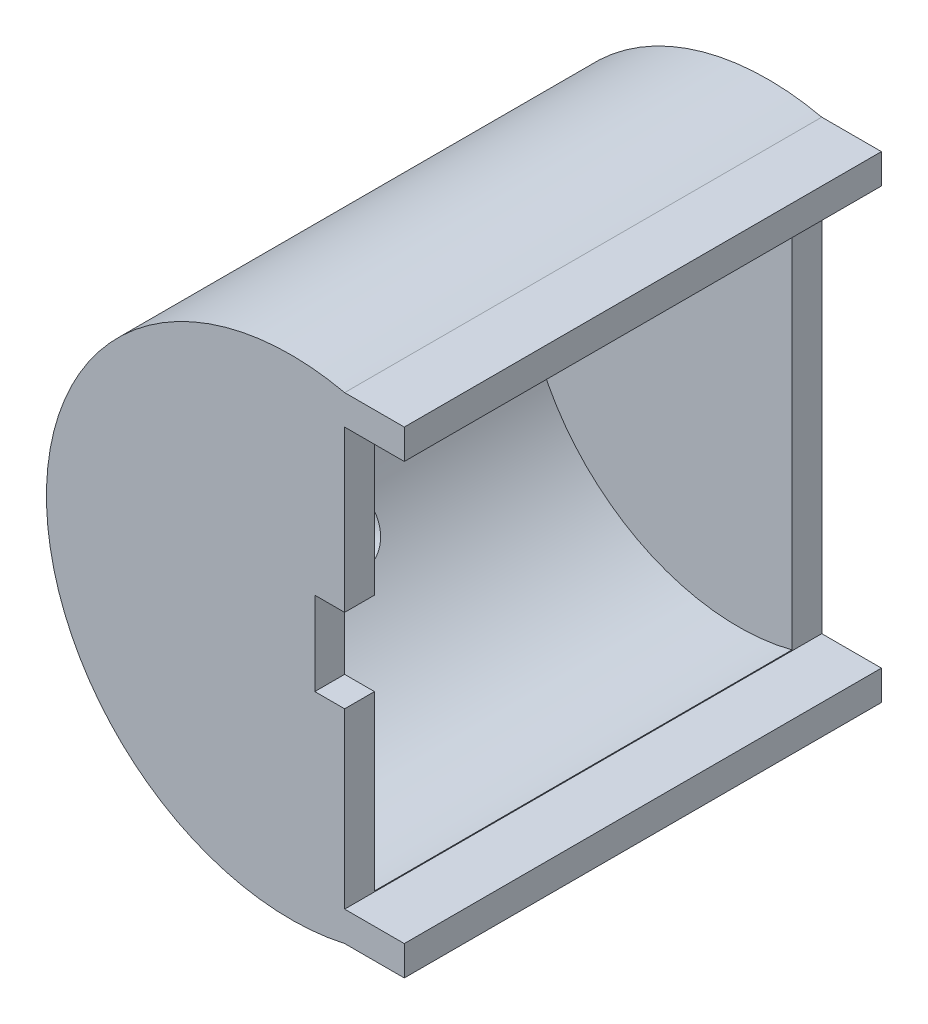
from build123d import *

# Parameters (mm, degrees)
BOSS_EXTRUDE1_DEPTH                      = 101.6
SHELL1_T                                 = -6.35
SKETCH3_W                                = 6.35
SKETCH3_H                                = 17.78
CUT_EXTRUDE1_DEPTH                       = 6.35
SKETCH4_W                                = 12.7
SKETCH4_H                                = 6.35
BOSS_EXTRUDE2_DEPTH                      = 101.6
SKETCH6_W                                = 12.7
SKETCH6_H                                = 6.35
BOSS_EXTRUDE3_DEPTH                      = 101.6
F_1_2_0_5_DIAMETER_HOLE1_D               = 12.7
F_1_2_0_5_DIAMETER_HOLE1_DEPTH           = 7.62
F_1_2_0_5_DIAMETER_HOLE1_TIP             = 3.815464931
F_1_2_0_5_DIAMETER_HOLE1_ON_FACE_2_D     = 12.7
F_1_2_0_5_DIAMETER_HOLE1_ON_FACE_2_DEPTH = 7.62
F_1_2_0_5_DIAMETER_HOLE1_ON_FACE_2_TIP   = 3.815464931
F_1_2_0_5_DIAMETER_HOLE1_ON_FACE_3_D     = 12.7
F_1_2_0_5_DIAMETER_HOLE1_ON_FACE_3_DEPTH = 7.62
F_1_2_0_5_DIAMETER_HOLE1_ON_FACE_3_TIP   = 3.815464931


with BuildPart() as part:
    # Sketch2 → Boss-Extrude1 (new body)
    with BuildSketch(Plane.XY):
        with BuildLine():
            Line((0, -50.8), (0, 0))
            Line((0, 0), (0, 50.8))
            ThreePointArc((0, 50.8), (-63.5, 0), (0, -50.8))
        make_face()
    extrude(amount=BOSS_EXTRUDE1_DEPTH)

    # Shell1
    shell1_openings = [part.faces().sort_by_distance(p)[0] for p in [
        (0, 0, 50.8),
    ]]
    offset(amount=SHELL1_T, openings=shell1_openings)

    # Sketch3 → Cut-Extrude1 (cut)
    with BuildSketch(Plane.XY.offset(101.6)):
        with Locations((-3.175, 1.38458233)):
            Rectangle(SKETCH3_W, SKETCH3_H)
    extrude(amount=-CUT_EXTRUDE1_DEPTH, mode=Mode.SUBTRACT)

    # Sketch4 → Boss-Extrude2 (add)
    with BuildSketch(Plane.XY.offset(101.6)):
        with Locations((6.35, 47.625)):
            Rectangle(SKETCH4_W, SKETCH4_H)
    extrude(amount=-BOSS_EXTRUDE2_DEPTH)

    # Sketch6 → Boss-Extrude3 (add)
    with BuildSketch(Plane.XY.offset(101.6)):
        with Locations((6.35, -47.625)):
            Rectangle(SKETCH6_W, SKETCH6_H)
    extrude(amount=-BOSS_EXTRUDE3_DEPTH)

    # 1/2 (0.5) Diameter Hole1
    with Locations(Plane(origin=(-63.499461497, -0.236811011, 51.161863275), x_dir=(0.004547935689, -0.999989658087, 0), z_dir=(-0.999989658087, -0.004547935689, 0))):
        with Locations((0, 0)):
            Hole(F_1_2_0_5_DIAMETER_HOLE1_D / 2, depth=F_1_2_0_5_DIAMETER_HOLE1_DEPTH)
            with Locations((0, 0, -(F_1_2_0_5_DIAMETER_HOLE1_DEPTH + F_1_2_0_5_DIAMETER_HOLE1_TIP / 2))):  # 118° drill point
                Cone(0, F_1_2_0_5_DIAMETER_HOLE1_D / 2, F_1_2_0_5_DIAMETER_HOLE1_TIP, mode=Mode.SUBTRACT)

    # 1/2 (0.5) Diameter Hole1 on face 2
    with Locations(Plane(origin=(-55.14102988, -28.295419537, 51.457217049), x_dir=(0.543410902455, -0.839466849312, 0), z_dir=(-0.839466849312, -0.543410902455, 0))):
        with Locations((0, 0)):
            Hole(F_1_2_0_5_DIAMETER_HOLE1_ON_FACE_2_D / 2, depth=F_1_2_0_5_DIAMETER_HOLE1_ON_FACE_2_DEPTH)
            with Locations((0, 0, -(F_1_2_0_5_DIAMETER_HOLE1_ON_FACE_2_DEPTH + F_1_2_0_5_DIAMETER_HOLE1_ON_FACE_2_TIP / 2))):  # 118° drill point
                Cone(0, F_1_2_0_5_DIAMETER_HOLE1_ON_FACE_2_D / 2, F_1_2_0_5_DIAMETER_HOLE1_ON_FACE_2_TIP, mode=Mode.SUBTRACT)

    # 1/2 (0.5) Diameter Hole1 on face 3
    with Locations(Plane(origin=(-56.343520967, 26.345028645, 50.866509501), x_dir=(-0.505954201442, -0.862560343422, 0), z_dir=(-0.862560343422, 0.505954201442, 0))):
        with Locations((0, 0)):
            Hole(F_1_2_0_5_DIAMETER_HOLE1_ON_FACE_3_D / 2, depth=F_1_2_0_5_DIAMETER_HOLE1_ON_FACE_3_DEPTH)
            with Locations((0, 0, -(F_1_2_0_5_DIAMETER_HOLE1_ON_FACE_3_DEPTH + F_1_2_0_5_DIAMETER_HOLE1_ON_FACE_3_TIP / 2))):  # 118° drill point
                Cone(0, F_1_2_0_5_DIAMETER_HOLE1_ON_FACE_3_D / 2, F_1_2_0_5_DIAMETER_HOLE1_ON_FACE_3_TIP, mode=Mode.SUBTRACT)


solid = part.part
